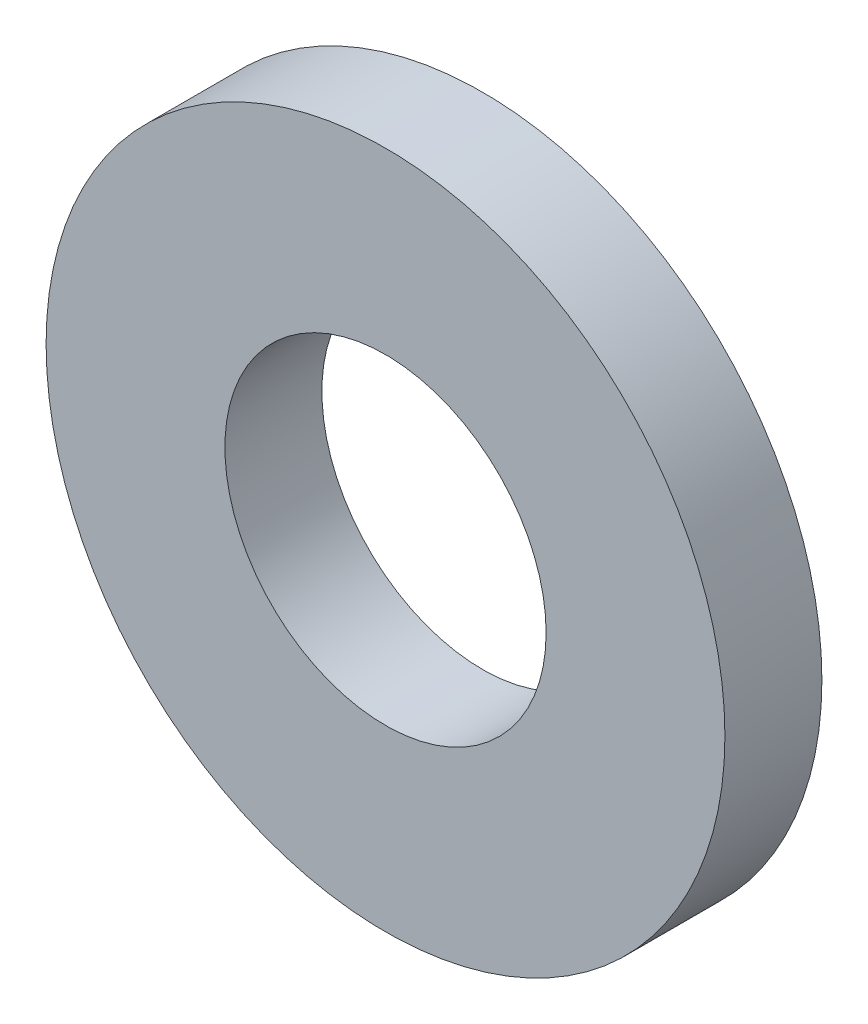
from build123d import *

# Parameters (mm, degrees)
SKETCH_1_R      = 2.8
SKETCH_1_R_2    = 1.325
EXTRUDE_1_DEPTH = 0.8


with BuildPart() as part:
    # Эскиз1 → Бобышка-Вытянуть1 (new body)
    with BuildSketch(Plane.XY):
        Circle(SKETCH_1_R)
        Circle(SKETCH_1_R_2, mode=Mode.SUBTRACT)
    extrude(amount=EXTRUDE_1_DEPTH)


solid = part.part
